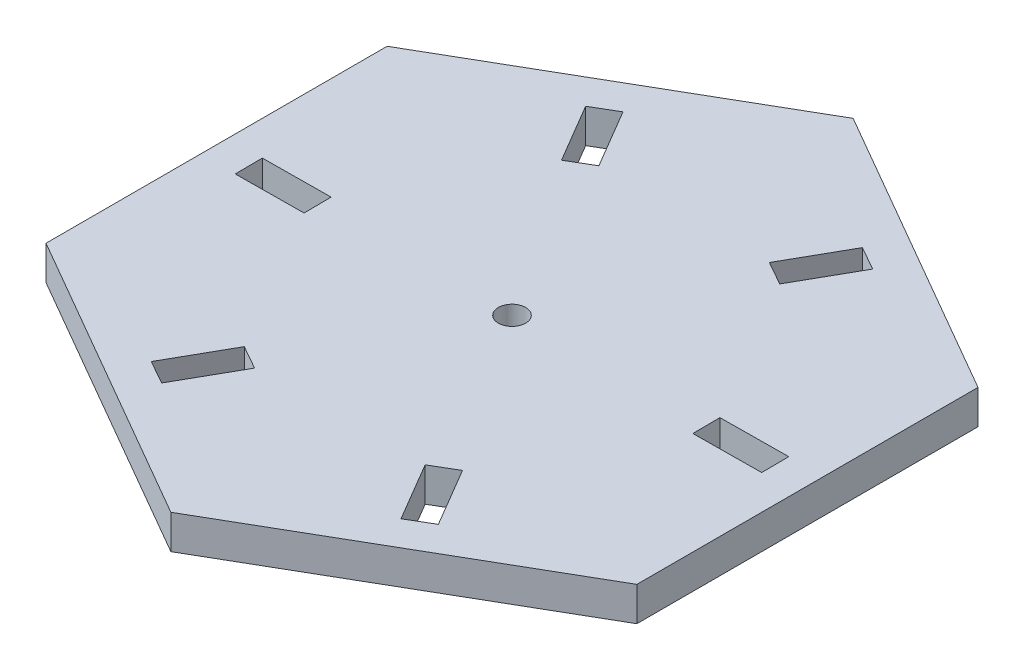
from build123d import *

# Parameters (mm, degrees)
SKETCH1_R           = 1.27
BOSS_EXTRUDE1_DEPTH = 3.175


with BuildPart() as part:
    # Sketch1 → Boss-Extrude1 (new body)
    with BuildSketch(Plane(origin=(0, 0, 0), x_dir=(1, 0, 0), z_dir=(0, 1, 0))):
        Polygon((27.49630657, 15.875), (0, 31.75), (-27.49630657, 15.875), (-27.49630657, -15.875), (0, -31.75), (27.49630657, -15.875), align=None)
        with Locations(Location((0, 0, 0), (0, 0, 270))):
            Circle(SKETCH1_R, mode=Mode.SUBTRACT)
        Polygon((-13.422443502, 20.276025186), (-11.234134179, 21.565560882), (-8.01029494, 16.094787576), (-10.198604263, 14.805251881), align=None, mode=Mode.SUBTRACT)
        Polygon((7.722422107, 16.234876315), (10.848331148, 21.762189646), (13.059256481, 20.51182603), (9.933347439, 14.984512698), align=None, mode=Mode.SUBTRACT)
        Polygon((17.921026369, 1.429624434), (24.27077465, 1.48616446), (24.29339066, -1.053734852), (17.94364238, -1.110274878), align=None, mode=Mode.SUBTRACT)
        Polygon((10.198604263, -14.805251881), (13.422443502, -20.276025186), (11.234134179, -21.565560882), (8.01029494, -16.094787576), align=None, mode=Mode.SUBTRACT)
        Polygon((-7.722422107, -16.234876315), (-10.848331148, -21.762189646), (-13.059256481, -20.51182603), (-9.933347439, -14.984512698), align=None, mode=Mode.SUBTRACT)
        Polygon((-17.921026369, -1.429624434), (-24.27077465, -1.48616446), (-24.29339066, 1.053734852), (-17.94364238, 1.110274878), align=None, mode=Mode.SUBTRACT)
    extrude(amount=-BOSS_EXTRUDE1_DEPTH)


solid = part.part
